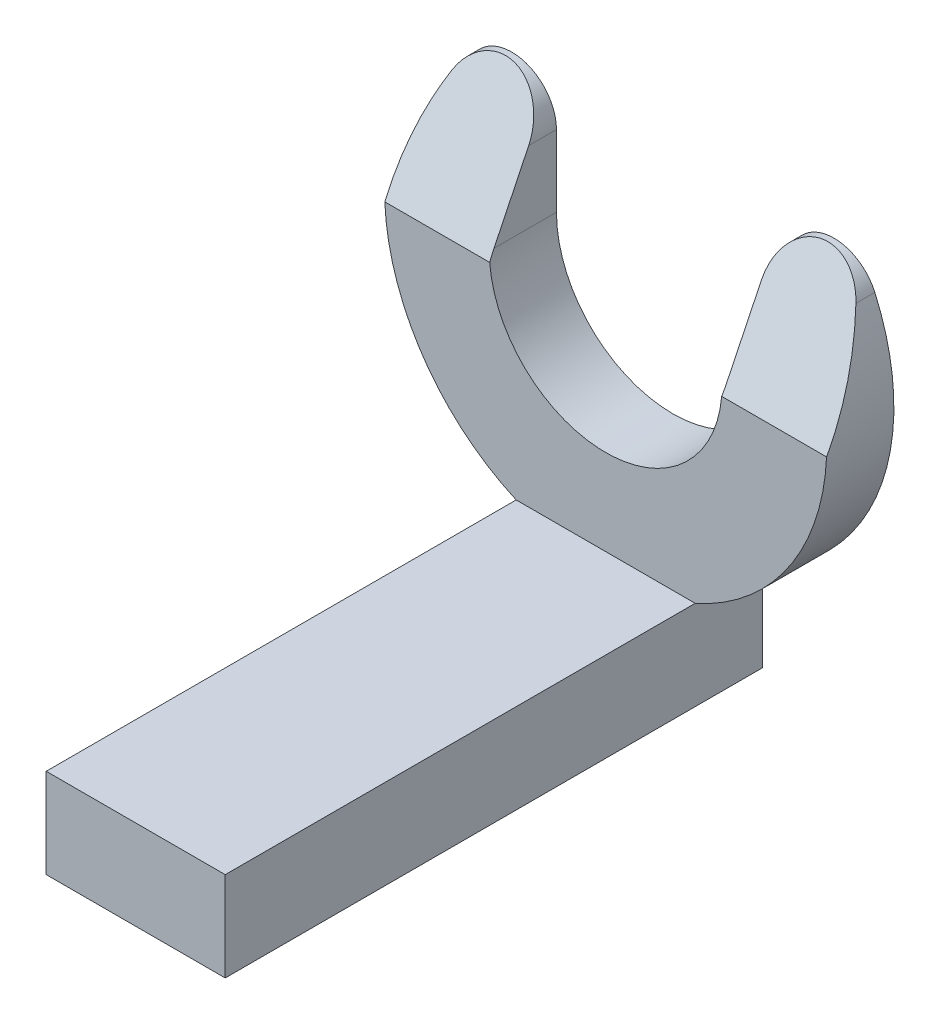
from build123d import *

# Parameters (mm, degrees)
SKETCH1_W               = 4
SKETCH1_H               = 2
BOSS_EXTRUDE1_DEPTH     = 12
BOSS_EXTRUDE2_DEPTH     = 1.5
CUT_EXTRUDE2_DEPTH      = 16.859104004
CUT_EXTRUDE2_DEPTH_BACK = 16.859104004


with BuildPart() as part:
    # Sketch1 → Boss-Extrude1 (new body)
    with BuildSketch(Plane.XY):
        with Locations((0, 1)):
            Rectangle(SKETCH1_W, SKETCH1_H)
    extrude(amount=BOSS_EXTRUDE1_DEPTH)

    # Sketch2 → Boss-Extrude2 (add)
    with BuildSketch(Plane(origin=(0, 0, 0), x_dir=(-1, 0, 0), z_dir=(0, 0, -1))):
        with BuildLine():
            Line((-2.6, 6.516547752), (-2.6, 8.116577001))
            ThreePointArc((-2.6, 8.116577001), (-3.392405194, 9.094791904), (-4.513808793, 8.522721667))
            ThreePointArc((-4.513808793, 8.522721667), (0, 1.576992752), (4.513808793, 8.522721667))
            ThreePointArc((4.513808793, 8.522721667), (3.392405194, 9.094791904), (2.6, 8.116577001))
            Line((2.6, 8.116577001), (2.6, 6.516547752))
            ThreePointArc((2.6, 6.516547752), (0, 3.916547752), (-2.6, 6.516547752))
        make_face()
    extrude(amount=-BOSS_EXTRUDE2_DEPTH)

    # Sketch3 → Cut-Extrude2 (cut, two sides: drawn at the far end of the back side and taken through both)
    with BuildSketch(Plane(origin=(0, 0, 0), x_dir=(0, 0, -1), z_dir=(1, 0, 0)).offset(-CUT_EXTRUDE2_DEPTH_BACK)):
        Polygon((-0.13532, 9.116577001), (-1.5, 6.3), (-1.5, 9.116577001), align=None)
    extrude(amount=CUT_EXTRUDE2_DEPTH + CUT_EXTRUDE2_DEPTH_BACK, mode=Mode.SUBTRACT)


solid = part.part
